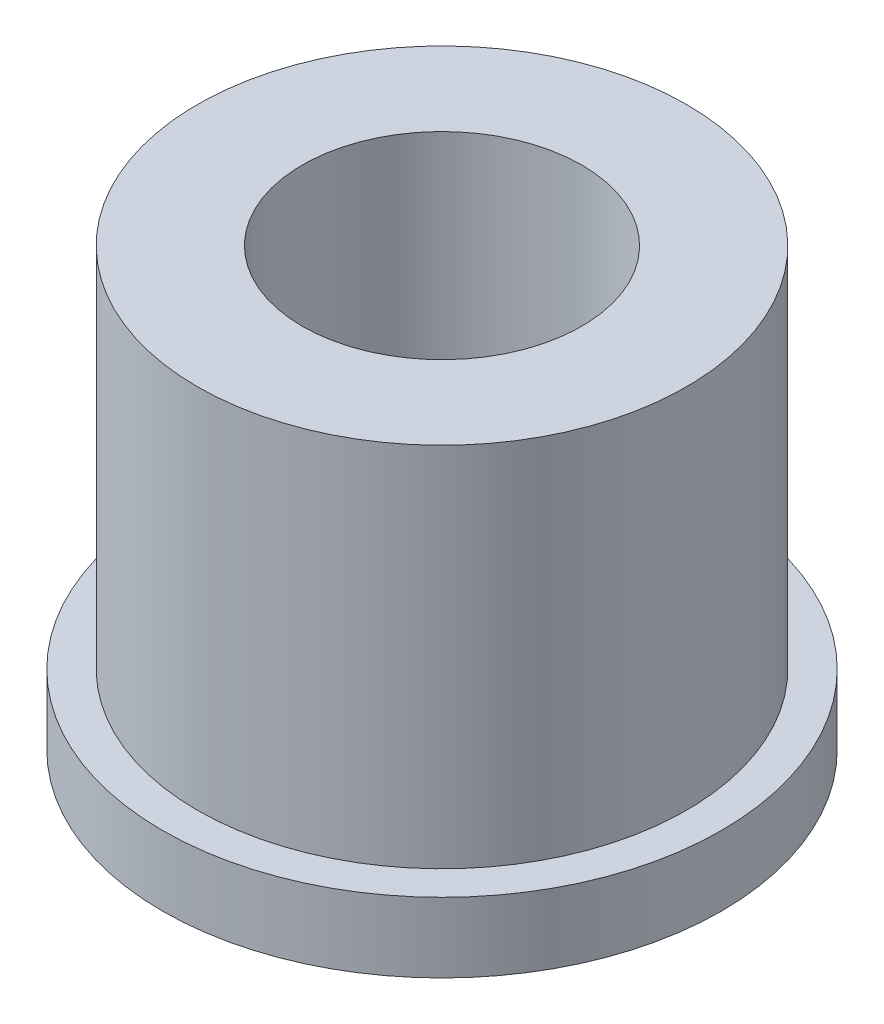
from build123d import *

# Parameters (mm, degrees)
SKETCH1_R           = 3.5
SKETCH1_R_2         = 2
BOSS_EXTRUDE1_DEPTH = 6.25
SKETCH2_R           = 4
SKETCH2_R_2         = 2
BOSS_EXTRUDE2_DEPTH = 1


with BuildPart() as part:
    # Sketch1 → Boss-Extrude1 (new body)
    with BuildSketch(Plane(origin=(0, 0, 0), x_dir=(1, 0, 0), z_dir=(0, 1, 0))):
        with Locations(Location((0, 0, 0), (0, 0, 270))):
            Circle(SKETCH1_R)
        with Locations(Location((0, 0, 0), (0, 0, 270))):
            Circle(SKETCH1_R_2, mode=Mode.SUBTRACT)
    extrude(amount=BOSS_EXTRUDE1_DEPTH)

    # Sketch2 → Boss-Extrude2 (add)
    with BuildSketch(Plane.XZ):
        with Locations(Location((0, 0, 0), (0, 0, 270))):
            Circle(SKETCH2_R)
        with Locations(Location((0, 0, 0), (0, 0, 90))):
            Circle(SKETCH2_R_2, mode=Mode.SUBTRACT)
    extrude(amount=-BOSS_EXTRUDE2_DEPTH)


solid = part.part
